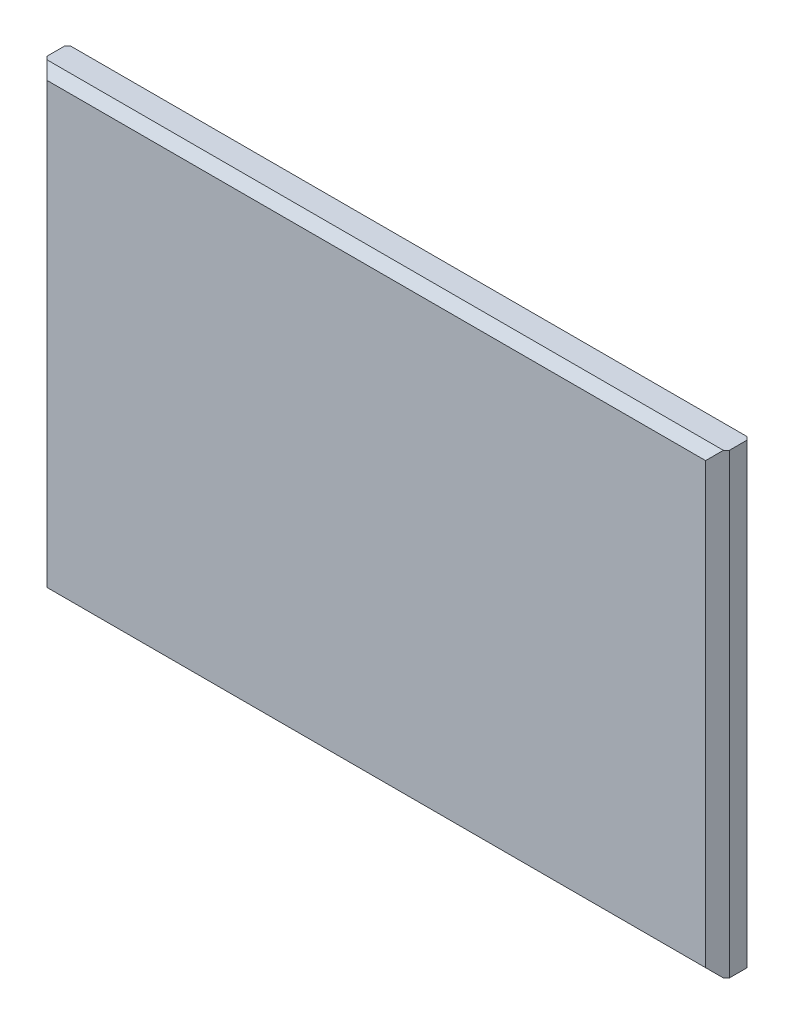
from build123d import *

# Parameters (mm, degrees)
SKETCH3_W           = 29.21
SKETCH3_H           = 19.558
BOSS_EXTRUDE1_DEPTH = 1.778
CHAMFER1_SIZE       = 0.381
CHAMFER2_SIZE       = 0.508


with BuildPart() as part:
    # Sketch3 → Boss-Extrude1 (new body)
    with BuildSketch(Plane.XY):
        Rectangle(SKETCH3_W, SKETCH3_H)
    extrude(amount=BOSS_EXTRUDE1_DEPTH)

    # Chamfer1
    chamfer1_edges = [part.edges().sort_by_distance(p)[0] for p in [
        (0, -9.779, 1.778),
        (0, -9.779, 0),
        (0, 9.779, 0),
        (0, 9.779, 1.778),
    ]]
    chamfer(chamfer1_edges, length=CHAMFER1_SIZE)

    # Chamfer2
    chamfer2_edges = [part.edges().sort_by_distance(p)[0] for p in [
        (14.605, 0, 1.778),
        (14.605, 0, 0),
        (-14.605, 0, 0),
        (-14.605, 0, 1.778),
    ]]
    chamfer(chamfer2_edges, length=CHAMFER2_SIZE)


solid = part.part
